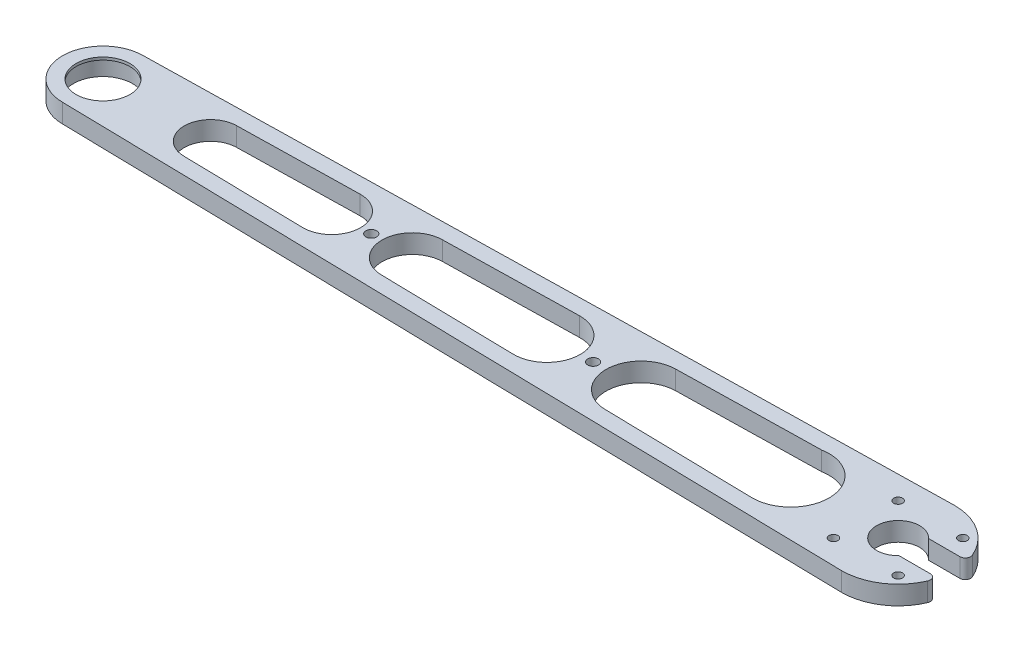
from build123d import *

# Parameters (mm, degrees)
SKETCH1_R             = 10
BOSS_EXTRUDE1_DEPTH   = 7
CIRPATTERN1_COUNT     = 4
SKETCH4_R             = 11
CUT_EXTRUDE2_DEPTH    = 6
M4_TAPPED_HOLE1_D     = 3.3
M4_TAPPED_HOLE1_DEPTH = 5
M4_TAPPED_HOLE1_TIP   = 0.991420021
SKETCH7_R             = 2
CUT_EXTRUDE3_DEPTH    = 7


with BuildPart() as part:
    # Sketch1 → Boss-Extrude1 (new body)
    with BuildSketch(Plane(origin=(0, 0, 0), x_dir=(1, 0, 0), z_dir=(0, 1, 0))):
        with BuildLine():
            Line((246.627930173, -20.982691565), (247.480370611, -21))
            ThreePointArc((247.480370611, -21), (259.0328823, -17.536803406), (266.775049308, -8.289473684))
            ThreePointArc((266.775049308, -8.289473684), (266.607632614, -6.399760792), (264.937460861, -5.5))
            Line((264.937460861, -5.5), (253.28984563, -5.5))
            ThreePointArc((253.28984563, -5.5), (239.480370611, 0), (253.28984563, 5.5))
            Line((253.28984563, 5.5), (264.937460861, 5.5))
            ThreePointArc((264.937460861, 5.5), (266.607632614, 6.399760792), (266.775049308, 8.289473684))
            ThreePointArc((266.775049308, 8.289473684), (259.0328823, 17.536803406), (247.480370611, 21))
            Line((247.480370611, 21), (246.627930173, 20.982691565))
            Line((246.627930173, 20.982691565), (-48.019629389, 15))
            ThreePointArc((-48.019629389, 15), (-63.019629389, 0), (-48.019629389, -15))
            Line((-48.019629389, -15), (246.627930173, -20.982691565))
        make_face()
        with Locations((-48.019629389, 0)):
            Circle(SKETCH1_R, mode=Mode.SUBTRACT)
    extrude(amount=BOSS_EXTRUDE1_DEPTH)

    # Sketch3 → Tap Drill for M4 Tap1 (revolve, cut)
    with BuildSketch(Plane(origin=(259.501185891, 7, -12.02081528), x_dir=(0, 0, 1), z_dir=(1, 0, 0))):
        Polygon((0, 0), (0, 8.991420021), (1.65, 8), (1.65, 0), align=None)
    tap_drill_for_m4_tap1 = revolve(axis=Axis((259.501185891, 13.35, -12.02081528), (0, -1, 0)), mode=Mode.SUBTRACT)

    # CirPattern1: Tap Drill for M4 Tap1 ×4 about axis
    cirpattern1_axis = Axis((247.480370611, 52.133884237, 0), (0, -1, 0))
    for i in range(1, CIRPATTERN1_COUNT):
        add(tap_drill_for_m4_tap1.rotate(cirpattern1_axis, i * 360 / CIRPATTERN1_COUNT), mode=Mode.SUBTRACT)

    # Sketch4 → Cut-Extrude2 (cut)
    with BuildSketch(Plane(origin=(0, 0, 0), x_dir=(1, 0, 0), z_dir=(0, 1, 0))):
        with Locations((-48.019629389, 0)):
            Circle(SKETCH4_R)
    extrude(amount=CUT_EXTRUDE2_DEPTH, mode=Mode.SUBTRACT)

    # M4 Tapped Hole1
    with Locations(Plane(origin=(0, 0, 0), x_dir=(-1, 0, 0), z_dir=(0, -1, 0))):
        with Locations((33.019629389, -10), (33.019629389, 10)):
            Hole(M4_TAPPED_HOLE1_D / 2, depth=M4_TAPPED_HOLE1_DEPTH)
            with Locations((0, 0, -(M4_TAPPED_HOLE1_DEPTH + M4_TAPPED_HOLE1_TIP / 2))):  # 118° drill point
                Cone(0, M4_TAPPED_HOLE1_D / 2, M4_TAPPED_HOLE1_TIP, mode=Mode.SUBTRACT)

    # Sketch7 → Cut-Extrude3 (cut)
    with BuildSketch(Plane(origin=(0, 0, 0), x_dir=(-1, 0, 0), z_dir=(0, -1, 0))):
        with Locations((-134.125113886, 0)):
            Circle(SKETCH7_R)
        with Locations((-51.675864847, 0)):
            Circle(SKETCH7_R)
        with BuildLine():
            Line((8.218754321, -9.806902896), (-36.762700927, -10.720231937))
            ThreePointArc((-36.762700927, -10.720231937), (-47.702812165, 0), (-36.762700927, 10.720231937))
            Line((-36.762700927, 10.720231937), (8.218754321, 9.806902896))
            ThreePointArc((8.218754321, 9.806902896), (17.82855365, 0), (8.218754321, -9.806902896))
        make_face()
        with BuildLine():
            Line((-66.750337759, 11.329117964), (-116.729732479, 12.343928009))
            ThreePointArc((-116.729732479, 12.343928009), (-129.326842907, 0), (-116.729732479, -12.343928009))
            Line((-116.729732479, -12.343928009), (-66.750337759, -11.329117964))
            ThreePointArc((-66.750337759, -11.329117964), (-55.648917529, 0), (-66.750337759, 11.329117964))
        make_face()
        with BuildLine():
            Line((-151.715308783, -13.05429504), (-207.190686799, -14.180698655))
            ThreePointArc((-207.190686799, -14.180698655), (-221.709735655, 1.233303858), (-204.918313244, 14.13455909))
            Line((-204.918313244, 14.13455909), (-151.715308783, 13.05429504))
            ThreePointArc((-151.715308783, 13.05429504), (-138.923384865, 0), (-151.715308783, -13.05429504))
        make_face()
    extrude(amount=-CUT_EXTRUDE3_DEPTH, mode=Mode.SUBTRACT)


solid = part.part
